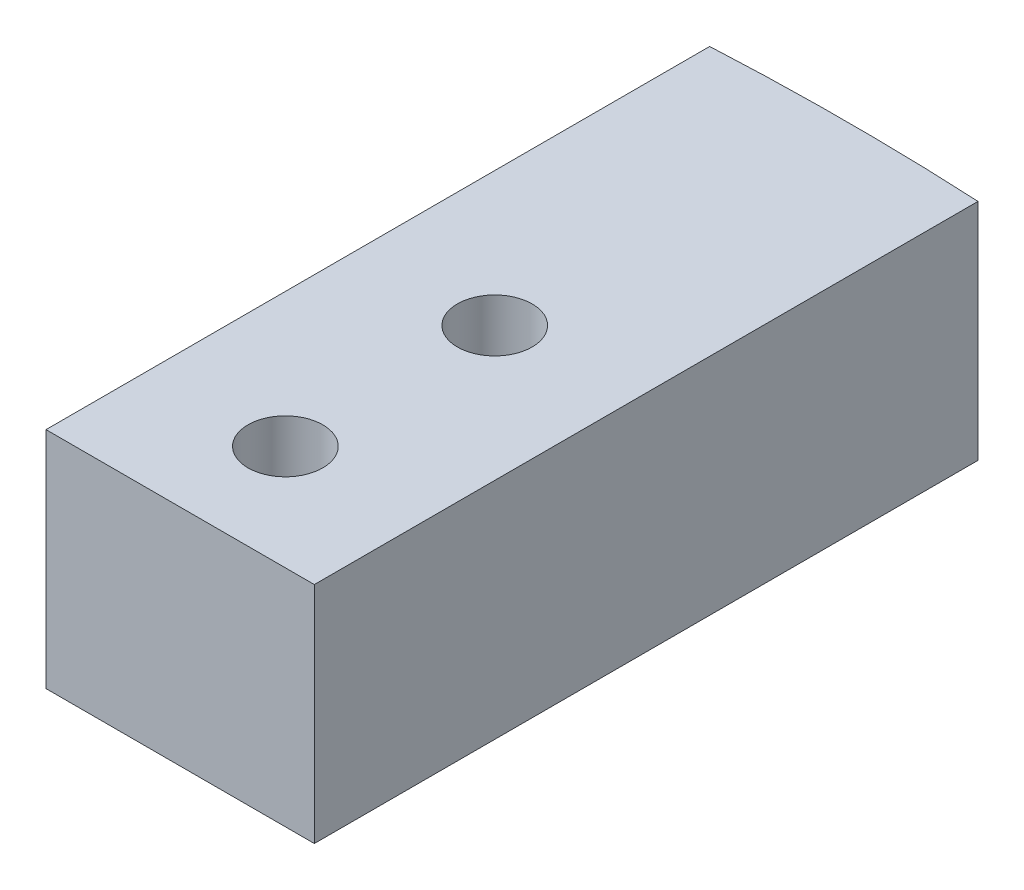
from build123d import *

# Parameters (mm, degrees)
BOSS_EXTRUDE1_DEPTH   = 7.5
M6X1_0_TAPPED_HOLE1_D = 5
SKETCH6_W             = 17.945345232
SKETCH6_H             = 44.380970223
SKETCH6_R             = 2.5
BOSS_EXTRUDE2_DEPTH   = 15
CUT_EXTRUDE1_START    = -15
SKETCH8_R             = 2.5
CUT_EXTRUDE1_DEPTH    = 20


with BuildPart() as part:
    # Sketch1 → Boss-Extrude1 (new, symmetric)
    with BuildSketch(Plane(origin=(0, 0, 0), x_dir=(1, 0, 0), z_dir=(0, 1, 0))):
        with BuildLine():
            Line((-7.5, -0.193392624), (-8.972672616, 28.343633506))
            ThreePointArc((-8.972672616, 28.343633506), (0, 28.575), (8.972672616, 28.343633506))
            Line((8.972672616, 28.343633506), (7.5, -0.193392624))
            Line((7.5, -0.193392624), (7.026752085, -9.363854534))
            ThreePointArc((7.026752085, -9.363854534), (0, -16.037336717), (-7.026752085, -9.363854534))
            Line((-7.026752085, -9.363854534), (-7.5, -0.193392624))
        make_face()
    extrude(amount=BOSS_EXTRUDE1_DEPTH, both=True)

    # M6x1.0 Tapped Hole1 (through all)
    with Locations(Plane(origin=(0, 7.5, 0), x_dir=(1, 0, 0), z_dir=(0, 1, 0))):
        with Locations((0, -9.00123422), (0, 5)):
            Hole(M6X1_0_TAPPED_HOLE1_D / 2)

    # Sketch6 → Boss-Extrude2 (add, through all)
    with BuildSketch(Plane(origin=(0, 7.5, 0), x_dir=(1, 0, 0), z_dir=(0, 1, 0))):
        with Locations((0, 6.153148395)):
            Rectangle(SKETCH6_W, SKETCH6_H)
        with Locations(Location((0, -9.00123422, 0), (0, 0, 270))):
            Circle(SKETCH6_R, mode=Mode.SUBTRACT)
        with Locations(Location((0, 5, 0), (0, 0, 270))):
            Circle(SKETCH6_R, mode=Mode.SUBTRACT)
    extrude(amount=-BOSS_EXTRUDE2_DEPTH)

    # Sketch8 → Cut-Extrude1 (cut)
    with BuildSketch(Plane.XY.offset(CUT_EXTRUDE1_START)):
        Circle(SKETCH8_R)
    extrude(amount=-CUT_EXTRUDE1_DEPTH, mode=Mode.SUBTRACT)


solid = part.part
